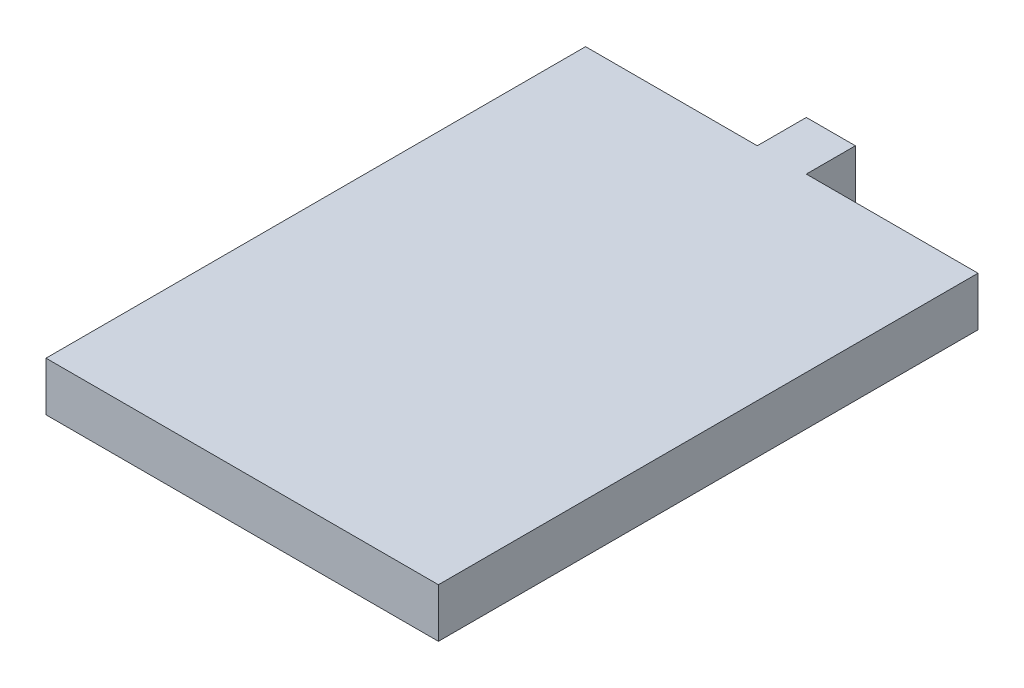
from build123d import *

# Parameters (mm, degrees)
BOSS_EXTRUDE1_DEPTH = 3.175


with BuildPart() as part:
    # Sketch1 → Boss-Extrude1 (new body)
    with BuildSketch(Plane(origin=(0, 0, 0), x_dir=(1, 0, 0), z_dir=(0, 1, 0))):
        Polygon((0, 34.925), (0, 0), (11.1125, 0), (14.2875, 0), (25.4, 0), (25.4, 34.925), (14.2875, 34.925), (14.2875, 38.1), (11.1125, 38.1), (11.1125, 34.925), align=None)
    extrude(amount=BOSS_EXTRUDE1_DEPTH)


solid = part.part
